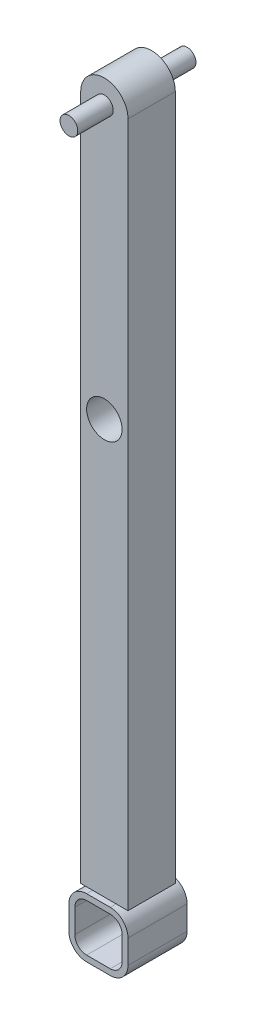
from build123d import *

# Parameters (mm, degrees)
EXTRUDE_1_DEPTH     = 50
SKETCH_2_W          = 40
SKETCH_2_H          = 40
EXTRUDE_2_DEPTH     = 600
FILLET_1_RADIUS     = 20
FILLET_1_LENGTH     = 40
SKETCH_5_R          = 7.5
EXTRUDE_4_DEPTH     = 30
SKETCH_6_R          = 15
CUT_EXTRUDE_1_DEPTH = 631.892225344


with BuildPart() as part:
    # 草图1 → 凸台-拉伸1 (new body)
    with BuildSketch(Plane.XY):
        with BuildLine():
            Line((-10, 25), (10, 25))
            ThreePointArc((10, 25), (20.606601718, 20.606601718), (25, 10))
            Line((25, 10), (25, -10))
            ThreePointArc((25, -10), (20.606601718, -20.606601718), (10, -25))
            Line((10, -25), (-10, -25))
            ThreePointArc((-10, -25), (-20.606601718, -20.606601718), (-25, -10))
            Line((-25, -10), (-25, 10))
            ThreePointArc((-25, 10), (-20.606601718, 20.606601718), (-10, 25))
        make_face()
        with BuildLine():
            Line((-10, 20), (10, 20))
            ThreePointArc((10, 20), (17.071067812, 17.071067812), (20, 10))
            Line((20, 10), (20, -10))
            ThreePointArc((20, -10), (17.071067812, -17.071067812), (10, -20))
            Line((10, -20), (-10, -20))
            ThreePointArc((-10, -20), (-17.071067812, -17.071067812), (-20, -10))
            Line((-20, -10), (-20, 10))
            ThreePointArc((-20, 10), (-17.071067812, 17.071067812), (-10, 20))
        make_face(mode=Mode.SUBTRACT)
    extrude(amount=EXTRUDE_1_DEPTH)

    # 草图2 → 凸台-拉伸2 (add)
    with BuildSketch(Plane(origin=(0, 25, 0), x_dir=(1, 0, 0), z_dir=(0, 1, 0))):
        with Locations((0, -25)):
            Rectangle(SKETCH_2_W, SKETCH_2_H)
    extrude(amount=EXTRUDE_2_DEPTH)

    # 圆角1: full round fillet: the end face becomes a half cylinder, R = half its width
    fillet_1_face = Plane((0, 625, 25), x_dir=(0, 0, -1), z_dir=(0, 1, 0))  # on the end face: x along it, z out of the body
    fillet_1_slab = fillet_1_face.offset(-FILLET_1_RADIUS / 2) * Box(FILLET_1_LENGTH, 2 * FILLET_1_RADIUS, FILLET_1_RADIUS, mode=Mode.PRIVATE)  # the body's end, R deep
    fillet_1_round = Plane((0, 605, 25), x_dir=(0, 1, 0), z_dir=(0, 0, -1)) * Cylinder(FILLET_1_RADIUS, FILLET_1_LENGTH, mode=Mode.PRIVATE)  # its axis R under the face
    add(fillet_1_slab - fillet_1_round, mode=Mode.SUBTRACT)

    # 草图5 → 凸台-拉伸4 (add)
    with BuildSketch(Plane.XY.offset(45)):
        with Locations(Location((0, 605, 0), (0, 0, 180))):
            Circle(SKETCH_5_R)
    extrude_4 = extrude(amount=EXTRUDE_4_DEPTH)

    # 镜向2: 凸台-拉伸4 across plane
    add(extrude_4.mirror(Plane.XY.offset(25)))

    # 草图6 → 切除-拉伸1 (cut, through all)
    with BuildSketch(Plane(origin=(25, 0, 45), x_dir=(1, 0, 0), z_dir=(0, 0, 1))):
        with Locations((-25, 375)):
            Circle(SKETCH_6_R)
    extrude(amount=-CUT_EXTRUDE_1_DEPTH, mode=Mode.SUBTRACT)


solid = part.part
